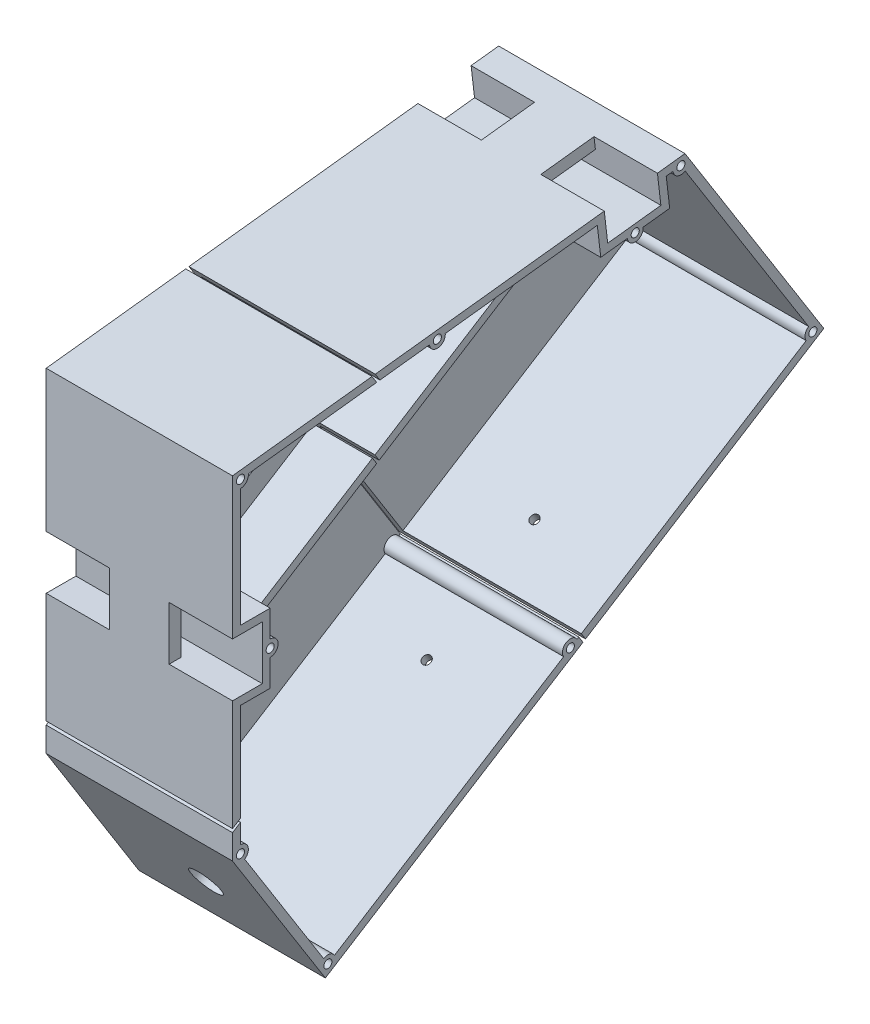
from build123d import *

# Parameters (mm, degrees)
BOSS_EXTRUDE1_DEPTH      = 47
BOSS_EXTRUDE1_DEPTH_BACK = 47
SHELL2_T                 = -4
BOSS_EXTRUDE2_DEPTH      = 30
SKETCH3_R                = 2.175
CUT_EXTRUDE1_DEPTH       = 4
BOSS_EXTRUDE3_DEPTH      = 15
BOSS_EXTRUDE3_DEPTH_BACK = 15
SKETCH4_W                = 6
SKETCH4_H                = 27
SKETCH5_R                = 4
BOSS_EXTRUDE4_DEPTH      = 90
SKETCH8_R                = 2.05
CUT_EXTRUDE2_DEPTH       = 6.2
CUT_EXTRUDE3_DEPTH       = 22
SKETCH11_R               = 12.375
CUT_EXTRUDE4_DEPTH       = 4
SKETCH13_R               = 6.15
SKETCH13_R_2             = 5.6
CUT_EXTRUDE5_DEPTH       = 4
SKETCH14_R               = 7.75
CUT_EXTRUDE6_DEPTH       = 4
CUT_EXTRUDE_THIN1_DEPTH  = 338.277207123


with BuildPart() as part:
    # Sketch1 → Boss-Extrude1 (new, two sides: drawn at the far end of the back side and taken through both)
    with BuildSketch(Plane(origin=(-56.774468418, 0, 0), x_dir=(0, 0, -1), z_dir=(1, 0, 0)).offset(-BOSS_EXTRUDE1_DEPTH_BACK)):
        Polygon((-234.630256956, -109.15088932), (16.819861226, 48.905550176), (-53.206472208, 160.309614915), (-67.111990866, 158.685868975), (-65.372263073, 143.787098985), (-92.190049054, 140.655588958), (-93.929776847, 155.554358948), (-281.461794585, 133.656265111), (-281.461794585, 62.352849401), (-266.461794585, 62.352849401), (-266.461794585, 35.352849401), (-281.461794585, 35.352849401), (-281.461794585, -34.647150599), align=None)
    extrude(amount=BOSS_EXTRUDE1_DEPTH + BOSS_EXTRUDE1_DEPTH_BACK)

    # Shell2
    shell2_openings = [part.faces().sort_by_distance(p)[0] for p in [
        (-9.774468418, 45.163408996, 157.760469451),
    ]]
    offset(amount=SHELL2_T, openings=shell2_openings, kind=Kind.INTERSECTION)

    # Sketch2 → Boss-Extrude2 (add)
    with BuildSketch(Plane(origin=(-99.774468418, 0, 0), x_dir=(0, 0, -1), z_dir=(1, 0, 0))):
        Polygon((-277.461794585, -33.49440081), (-277.461794585, -38.218995925), (-30.656037303, 116.918092596), (-32.784743559, 120.304626174), align=None)
    extrude(amount=BOSS_EXTRUDE2_DEPTH)

    # Sketch3 → Cut-Extrude1 (cut)
    with BuildSketch(Plane(origin=(0, 27.476586006, 17.27122415), x_dir=(1, 0, 0), z_dir=(0, -0.846633394553322, -0.5321765639589169))):
        with Locations(Location((-56.774468418, 138.320432901, 0), (0, 0, 270))):
            Circle(SKETCH3_R)
        with Locations(Location((-56.774468418, 74.080432901, 0), (0, 0, 270))):
            Circle(SKETCH3_R)
    extrude(amount=-CUT_EXTRUDE1_DEPTH, mode=Mode.SUBTRACT)

    # Sketch4 → Boss-Extrude3 (add, two sides: drawn at the far end of the back side and taken through both)
    with BuildSketch(Plane(origin=(-56.774468418, 0, 0), x_dir=(0, 0, -1), z_dir=(1, 0, 0)).offset(-BOSS_EXTRUDE3_DEPTH_BACK)):
        with Locations((-278.461794585, 48.852849401)):
            Rectangle(SKETCH4_W, SKETCH4_H)
        Polygon((-93.929776847, 155.554358948), (-93.23388573, 149.594850952), (-66.416099748, 152.726360979), (-67.111990866, 158.685868975), align=None)
    extrude(amount=BOSS_EXTRUDE3_DEPTH + BOSS_EXTRUDE3_DEPTH_BACK)

    # Sketch5 → Boss-Extrude4 (add)
    with BuildSketch(Plane(origin=(-99.774468418, 0, 0), x_dir=(0, 0, -1), z_dir=(1, 0, 0))):
        with Locations((-277.461794585, -33.49440081)):
            Circle(SKETCH5_R)
        with Locations((11.304621392, 50.163377498)):
            Circle(SKETCH5_R)
        with Locations((-233.372429634, -103.635649486)):
            Circle(SKETCH5_R)
        with Locations((-277.461794585, 130.096166602)):
            Circle(SKETCH5_R)
        with Locations((-55.249694114, 156.043850024)):
            Circle(SKETCH5_R)
        with Locations((-178.13666132, 141.694351887)):
            Circle(SKETCH5_R)
        with Locations((-262.461794585, 48.852849401)):
            Circle(SKETCH5_R)
        with Locations((-78.317228652, 138.248338641)):
            Circle(SKETCH5_R)
        with Locations((-111.033904121, -26.736135994)):
            Circle(SKETCH5_R)
    extrude(amount=BOSS_EXTRUDE4_DEPTH)

    # Sketch8 → Cut-Extrude2 (cut)
    with BuildSketch(Plane(origin=(-9.774468418, 0, 0), x_dir=(0, 0, -1), z_dir=(1, 0, 0))):
        with Locations((-262.461794585, 48.852849401)):
            Circle(SKETCH8_R)
        with Locations((-277.461794585, -33.49440081)):
            Circle(SKETCH8_R)
        with Locations((-233.372429634, -103.635649486)):
            Circle(SKETCH8_R)
        with Locations((-111.033904121, -26.736135994)):
            Circle(SKETCH8_R)
        with Locations((11.304621392, 50.163377498)):
            Circle(SKETCH8_R)
        with Locations((-55.249694114, 156.043850024)):
            Circle(SKETCH8_R)
        with Locations((-78.317228652, 138.248338641)):
            Circle(SKETCH8_R)
        with Locations((-178.13666132, 141.694351887)):
            Circle(SKETCH8_R)
        with Locations((-277.461794585, 130.096166602)):
            Circle(SKETCH8_R)
    extrude(amount=-CUT_EXTRUDE2_DEPTH, mode=Mode.SUBTRACT)

    # Sketch10 → Cut-Extrude3 (cut)
    with BuildSketch(Plane(origin=(-69.774468418, 0, 0), x_dir=(0, 0, -1), z_dir=(1, 0, 0))):
        Polygon((-249.934086492, -20.91563747), (-252.062792748, -17.529103892), (-274.075261007, -31.365694554), (-275.333088329, -36.880934389), align=None)
    extrude(amount=-CUT_EXTRUDE3_DEPTH, mode=Mode.SUBTRACT)

    # Sketch11 → Cut-Extrude4 (cut)
    with BuildSketch(Plane(origin=(0, 19.300257914, -30.704551798), x_dir=(1, 0, 0), z_dir=(0, -0.5321765639589167, 0.8466333945533221))):
        with Locations(Location((-49.774468418, 127.514526818, 0), (0, 0, 270))):
            Circle(SKETCH11_R)
    extrude(amount=-CUT_EXTRUDE4_DEPTH, mode=Mode.SUBTRACT)

    # Sketch13 → Cut-Extrude5 (cut)
    with BuildSketch(Plane(origin=(-99.774468418, 0, 0), x_dir=(0, 0, -1), z_dir=(1, 0, 0))):
        with Locations((-110.017987699, 129.51267176)):
            Circle(SKETCH13_R)
        with Locations((-134.849271015, 126.613125439)):
            Circle(SKETCH13_R_2)
    extrude(amount=-CUT_EXTRUDE5_DEPTH, mode=Mode.SUBTRACT)

    # Sketch14 → Cut-Extrude6 (cut)
    with BuildSketch(Plane(origin=(0, -134.49876907, 213.972499228), x_dir=(-1, 0, 0), z_dir=(0, 0.5321765639589167, -0.8466333945533221))):
        with Locations(Location((49.774468418, 70.453936004, 0), (0, 0, 90))):
            Circle(SKETCH14_R)
    extrude(amount=-CUT_EXTRUDE6_DEPTH, mode=Mode.SUBTRACT)

    # Sketch16 → Cut-Extrude-Thin1 (cut, through all)
    with BuildSketch(Plane.ZY.offset(103.774468418)):
        Polygon((216.416106978, 150.339399115), (211.094341338, 141.873065169), (188.98399877, 106.697982968), (200.52285554, 106.264257511), (184.557558621, 80.865255674), (179.1637475, 91.075061496), (141.911388023, 31.810723877), (153.450244793, 31.37699842), (137.484947875, 5.977996584), (132.091136754, 16.187802406), (104.659028546, -27.453613741), (99.337262907, -35.919947687), (98.067312815, -35.121682841), (103.389078454, -26.655348895), (132.203821933, 19.185685334), (137.597633054, 8.975879512), (150.797659431, 29.975645184), (139.25880266, 30.409370641), (179.27643268, 94.072944424), (184.670243801, 83.863138602), (197.870270177, 104.862904274), (186.331413407, 105.296629731), (209.824391246, 142.671330015), (215.146156886, 151.137663961), align=None)
        Polygon((157.876684942, 57.209725714), (212.907855588, 22.618249057), (213.341581045, 34.157105827), (238.740582882, 18.191808908), (228.53077706, 12.797997787), (281.461794585, -20.473365255), (289.92812853, -25.795130894), (289.129863684, -27.065080986), (280.663529739, -21.743315346), (225.532894132, 12.910682966), (235.742699954, 18.304494087), (214.742934281, 31.504520464), (214.309208824, 19.965663694), (157.078420096, 55.939775622), align=None)
    extrude(amount=-CUT_EXTRUDE_THIN1_DEPTH, mode=Mode.SUBTRACT)


with BuildPart() as cut_extrude_thin1_piece_1:
    # of the separate pieces the step leaves, piece 1, a body of its own (cut_extrude_thin1_pieces)
    add(part.part.solids().sort_by_distance((-103.774468418, -26.655348895, 103.389078454))[0])


with BuildPart() as cut_extrude_thin1_piece_2:
    # of the separate pieces the step leaves, piece 2, a body of its own (cut_extrude_thin1_pieces)
    add(part.part.solids().sort_by_distance((-9.774468418, -109.15088932, 234.630256956))[0])


with BuildPart() as cut_extrude_thin1_piece_3:
    # of the separate pieces the step leaves, piece 3, a body of its own (cut_extrude_thin1_pieces)
    add(part.part.solids().sort_by_distance((-103.774468418, 35.352849401, 281.461794585))[0])


solid = Compound([cut_extrude_thin1_piece_1.part, cut_extrude_thin1_piece_2.part, cut_extrude_thin1_piece_3.part])
